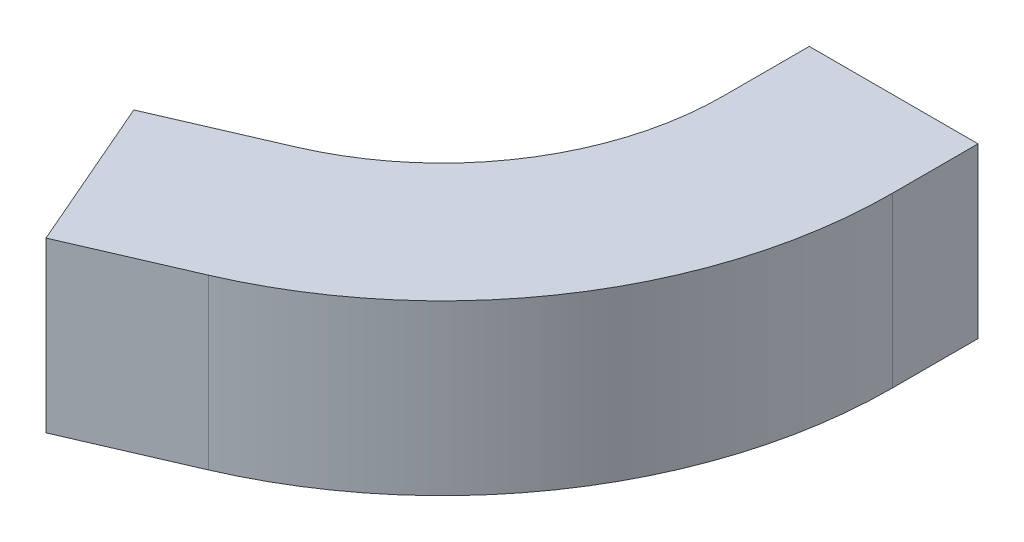
from build123d import *

# Parameters (mm, degrees)
BOSS_EXTRUDE1_DEPTH = 15


with BuildPart() as part:
    # Sketch1 → Boss-Extrude1 (new body)
    with BuildSketch(Plane(origin=(0, 0, 0), x_dir=(1, 0, 0), z_dir=(0, 1, 0))):
        with BuildLine():
            Line((15.892322519, -36.707411853), (9.932701575, -22.942132408))
            Line((9.932701575, -22.942132408), (-0.134306126, -27.300601859))
            Line((-0.134306126, -27.300601859), (5.215978235, -39.658461532))
            ThreePointArc((5.215978235, -39.658461532), (10.656794252, -38.554282982), (15.892322519, -36.707411853))
        make_face()
        with BuildLine():
            Line((40, 0), (25, 0))
            ThreePointArc((25, 0), (20.896381737, -13.723746949), (9.932701575, -22.942132408))
            Line((9.932701575, -22.942132408), (15.892322519, -36.707411853))
            ThreePointArc((15.892322519, -36.707411853), (33.434210779, -21.957995118), (40, 0))
        make_face()
        with BuildLine():
            Line((25, 7.62), (25, 0))
            Line((25, 0), (40, 0))
            ThreePointArc((40, 0), (39.816450827, 3.827563654), (39.267487824, 7.62))
            Line((39.267487824, 7.62), (25, 7.62))
        make_face()
        with BuildLine():
            Line((5.825314819, -41.065881304), (15.892322519, -36.707411853))
            ThreePointArc((15.892322519, -36.707411853), (10.656794252, -38.554282982), (5.215978235, -39.658461532))
            Line((5.215978235, -39.658461532), (5.825314819, -41.065881304))
        make_face()
        with BuildLine():
            ThreePointArc((39.267487824, 7.62), (39.816450827, 3.827563654), (40, 0))
            Line((40, 0), (40, 7.62))
            Line((40, 7.62), (39.267487824, 7.62))
        make_face()
    extrude(amount=BOSS_EXTRUDE1_DEPTH)


solid = part.part
